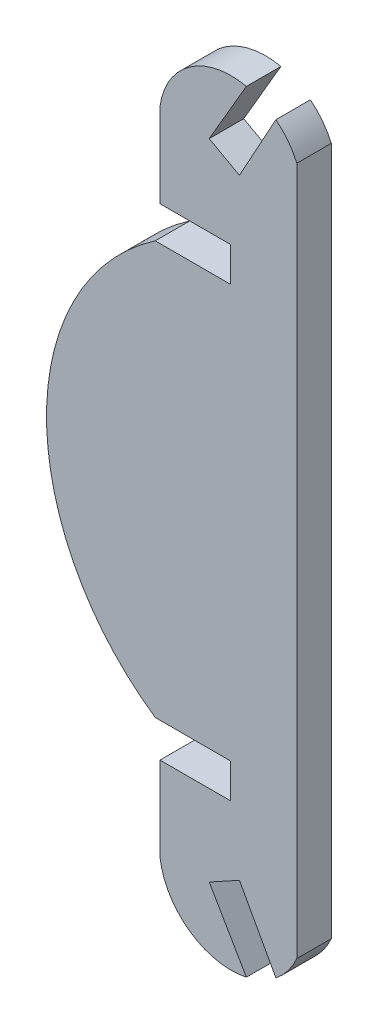
from build123d import *

# Parameters (mm, degrees)
BASE_EXTRUDE_DEPTH = 3


with BuildPart() as part:
    # Sketch1 → Base-Extrude (new body)
    with BuildSketch(Plane.XY):
        with BuildLine():
            Line((195.167267959, -118.672665529), (198.339039248, -124.445885207))
            ThreePointArc((198.339039248, -124.445885207), (199.392796981, -123.370856688), (200.158445725, -122.07475728))
            Line((200.158445725, -122.07475728), (200.158445725, -62.170573778))
            ThreePointArc((200.158445725, -62.170573778), (199.392796981, -60.874474369), (198.339039248, -59.79944585))
            Line((198.339039248, -59.79944585), (195.167267959, -65.572665529))
            Line((195.167267959, -65.572665529), (192.537947509, -64.128133088))
            Line((192.537947509, -64.128133088), (195.771956334, -58.576419897))
            ThreePointArc((195.771956334, -58.576419897), (190.863435389, -59.561310884), (188.258458895, -63.836551882))
            Line((188.258458895, -63.836551882), (188.258458895, -71.172665529))
            Line((188.258458895, -71.172665529), (194.386873079, -71.172665529))
            Line((194.386873079, -71.172665529), (194.386873079, -74.172665529))
            Line((194.386873079, -74.172665529), (187.843216204, -74.172665529))
            ThreePointArc((187.843216204, -74.172665529), (178.389950643, -92.122665529), (187.843216204, -110.072665529))
            Line((187.843216204, -110.072665529), (194.386873079, -110.072665529))
            Line((194.386873079, -110.072665529), (194.386873079, -113.072665529))
            Line((194.386873079, -113.072665529), (188.258458895, -113.072665529))
            Line((188.258458895, -113.072665529), (188.258458895, -120.408779175))
            ThreePointArc((188.258458895, -120.408779175), (190.863435389, -124.684020173), (195.771956334, -125.66891116))
            Line((195.771956334, -125.66891116), (192.537947509, -120.117197969))
            Line((192.537947509, -120.117197969), (195.167267959, -118.672665529))
        make_face()
    extrude(amount=BASE_EXTRUDE_DEPTH)


solid = part.part
